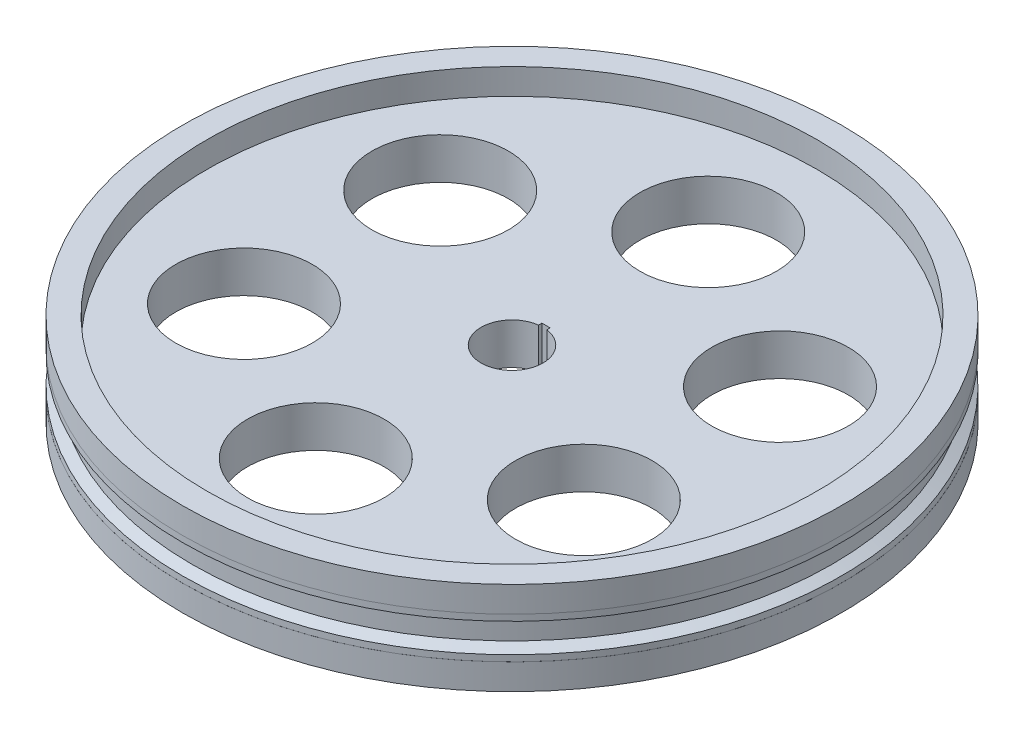
from build123d import *

# Parameters (mm, degrees)
CROQUIS1_R              = 155
CROQUIS1_R_2            = 33.0759403
SALIENTE_EXTRUIR1_DEPTH = 10
CROQUIS3_R              = 159.665159843
CROQUIS3_R_2            = 147.665159843
SALIENTE_EXTRUIR2_DEPTH = 12.5


with BuildPart() as part:
    # Croquis1 → Saliente-Extruir1 (new, symmetric)
    with BuildSketch(Plane(origin=(0, 0, 0), x_dir=(1, 0, 0), z_dir=(0, 1, 0))):
        with Locations(Location((0, 0, 0), (0, 0, 270))):
            Circle(CROQUIS1_R)
        with Locations(Location((0, 95.059598075, 0), (0, 0, 270))):
            Circle(CROQUIS1_R_2, mode=Mode.SUBTRACT)
        with Locations(Location((82.324026806, 47.529799037, 0), (0, 0, 270))):
            Circle(CROQUIS1_R_2, mode=Mode.SUBTRACT)
        with Locations(Location((82.324026806, -47.529799037, 0), (0, 0, 270))):
            Circle(CROQUIS1_R_2, mode=Mode.SUBTRACT)
        with Locations(Location((0, -95.059598075, 0), (0, 0, 270))):
            Circle(CROQUIS1_R_2, mode=Mode.SUBTRACT)
        with Locations(Location((-82.324026806, -47.529799037, 0), (0, 0, 270))):
            Circle(CROQUIS1_R_2, mode=Mode.SUBTRACT)
        with Locations(Location((-82.324026806, 47.529799037, 0), (0, 0, 270))):
            Circle(CROQUIS1_R_2, mode=Mode.SUBTRACT)
        with BuildLine():
            Line((-2, 16.5), (2, 16.5))
            Line((2, 16.5), (2, 14.866068747))
            ThreePointArc((2, 14.866068747), (0, -15), (-2, 14.866068747))
            Line((-2, 14.866068747), (-2, 16.5))
        make_face(mode=Mode.SUBTRACT)
    extrude(amount=SALIENTE_EXTRUIR1_DEPTH, both=True)

    # Croquis2 → Revolución1 (revolve)
    with BuildSketch(Plane(origin=(0, 0, 0), x_dir=(0, 0, -1), z_dir=(1, 0, 0)), mode=Mode.PRIVATE) as revoluci_n1_sk:
        Polygon((155, 10), (155, 4.5), (159.641767411, 7), (159.641767411, 10), align=None)
        Polygon((155, -4.5), (155, -10), (159.641767411, -10), (159.641767411, -7), align=None)
    revolve(revoluci_n1_sk.sketch.rotate(Axis((0, 10, 0), (0, -1, 0)), 180), axis=Axis((0, 10, 0), (0, -1, 0)))

    # Croquis3 → Saliente-Extruir2 (add)
    with BuildSketch(Plane(origin=(0, 10, 0), x_dir=(1, 0, 0), z_dir=(0, 1, 0))):
        with Locations(Location((0, 0, 0), (0, 0, 270))):
            Circle(CROQUIS3_R)
        with Locations(Location((0, 0, 0), (0, 0, 270))):
            Circle(CROQUIS3_R_2, mode=Mode.SUBTRACT)
    saliente_extruir2 = extrude(amount=SALIENTE_EXTRUIR2_DEPTH)

    # Simetría1: Saliente-Extruir2 across plane
    add(saliente_extruir2.mirror(Plane.ZX))


solid = part.part
